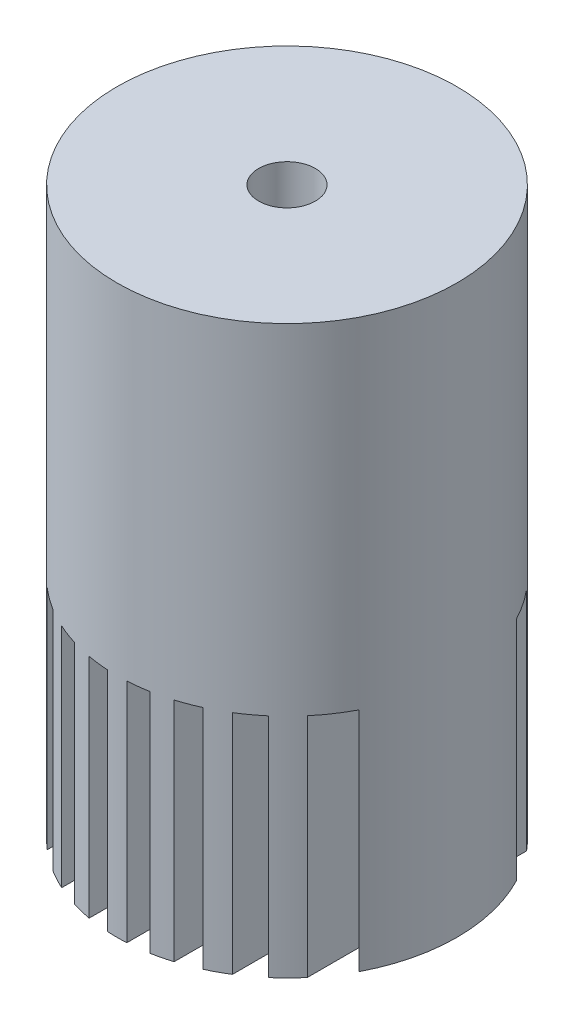
from build123d import *

# Parameters (mm, degrees)
ESQUISSE1_R             = 38.1
BOSS_EXTRU_1_DEPTH      = 63.5
ESQUISSE2_R             = 6.35
ENL_V_MAT_EXTRU_1_DEPTH = 17.78
ESQUISSE3_R             = 25.4
ENL_V_MAT_EXTRU_2_DEPTH = 50.8
ESQUISSE4_W             = 4.66725
ESQUISSE4_H             = 76.2
ENL_V_MAT_EXTRU_3_DEPTH = 50.8


with BuildPart() as part:
    # Esquisse1 → Boss.-Extru.1 (new, symmetric)
    with BuildSketch(Plane(origin=(0, 0, 0), x_dir=(1, 0, 0), z_dir=(0, 1, 0))):
        with Locations(Location((0, 0, 0), (0, 0, 270))):
            Circle(ESQUISSE1_R)
    extrude(amount=BOSS_EXTRU_1_DEPTH, both=True)

    # Esquisse2 → Enlèv. mat.-Extru.1 (cut)
    with BuildSketch(Plane(origin=(0, 63.5, 0), x_dir=(1, 0, 0), z_dir=(0, 1, 0))):
        with Locations(Location((0, 0, 0), (0, 0, 270))):
            Circle(ESQUISSE2_R)
    extrude(amount=-ENL_V_MAT_EXTRU_1_DEPTH, mode=Mode.SUBTRACT)

    # Esquisse3 → Enlèv. mat.-Extru.2 (cut)
    with BuildSketch(Plane(origin=(0, 45.72, 0), x_dir=(1, 0, 0), z_dir=(0, 1, 0))):
        with Locations(Location((0, 0, 0), (0, 0, 270))):
            Circle(ESQUISSE3_R)
    extrude(amount=-ENL_V_MAT_EXTRU_2_DEPTH, mode=Mode.SUBTRACT)

    # Esquisse4 → Enlèv. mat.-Extru.3 (cut)
    with BuildSketch(Plane.XZ.offset(63.5)):
        with Locations((22.458375, 0)):
            Rectangle(ESQUISSE4_W, ESQUISSE4_H)
        with Locations((31.448375, 0)):
            Rectangle(ESQUISSE4_W, ESQUISSE4_H)
        with Locations((13.468375, 0)):
            Rectangle(ESQUISSE4_W, ESQUISSE4_H)
        with Locations((4.478375, 0)):
            Rectangle(ESQUISSE4_W, ESQUISSE4_H)
        with Locations((-4.511625, 0)):
            Rectangle(ESQUISSE4_W, ESQUISSE4_H)
        with Locations((-13.501625, 0)):
            Rectangle(ESQUISSE4_W, ESQUISSE4_H)
        with Locations((-22.491625, 0)):
            Rectangle(ESQUISSE4_W, ESQUISSE4_H)
        with Locations((-31.481625, 0)):
            Rectangle(ESQUISSE4_W, ESQUISSE4_H)
    extrude(amount=-ENL_V_MAT_EXTRU_3_DEPTH, mode=Mode.SUBTRACT)


solid = part.part
